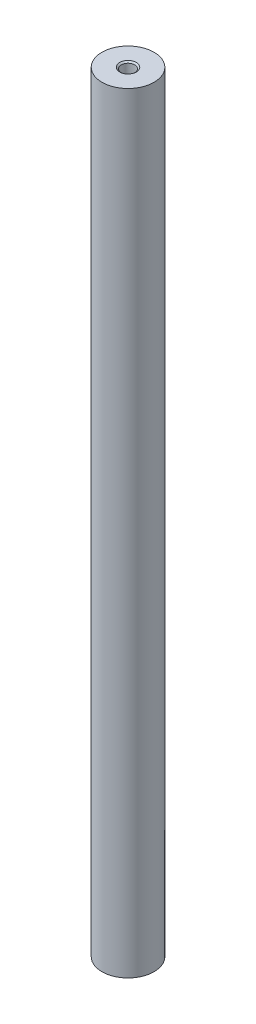
from build123d import *

# Parameters (mm, degrees)
SKETCH1_R                         = 6.35
BOSS_EXTRUDE1_DEPTH               = 187.8203
F_1_4_20_TAPPED_HOLE1_D           = 5.1054
F_1_4_20_TAPPED_HOLE1_DEPTH       = 21.59
F_1_4_20_TAPPED_HOLE1_CSINK_D     = 7.62
F_1_4_20_TAPPED_HOLE1_CSINK_ANGLE = 100
F_1_4_20_TAPPED_HOLE1_TIP         = 1.533816902
M4X0_7_TAPPED_HOLE1_D             = 3.3
M4X0_7_TAPPED_HOLE1_DEPTH         = 17.7292
M4X0_7_TAPPED_HOLE1_CSINK_D       = 4.05
M4X0_7_TAPPED_HOLE1_CSINK_ANGLE   = 100
M4X0_7_TAPPED_HOLE1_TIP           = 0.991420021


with BuildPart() as part:
    # Sketch1 → Boss-Extrude1 (new body)
    with BuildSketch(Plane(origin=(0, 0, 0), x_dir=(1, 0, 0), z_dir=(0, 1, 0))):
        with Locations(Location((0, 0, 0), (0, 0, 90))):
            Circle(SKETCH1_R)
    extrude(amount=BOSS_EXTRUDE1_DEPTH)

    # 1/4-20 Tapped Hole1
    with Locations(Plane(origin=(0, 0, 0), x_dir=(-1, 0, 0), z_dir=(0, -1, 0))):
        with Locations((0, 0)):
            CounterSinkHole(F_1_4_20_TAPPED_HOLE1_D / 2, F_1_4_20_TAPPED_HOLE1_CSINK_D / 2, depth=F_1_4_20_TAPPED_HOLE1_DEPTH, counter_sink_angle=F_1_4_20_TAPPED_HOLE1_CSINK_ANGLE)
            with Locations((0, 0, -(F_1_4_20_TAPPED_HOLE1_DEPTH + F_1_4_20_TAPPED_HOLE1_TIP / 2))):  # 118° drill point
                Cone(0, F_1_4_20_TAPPED_HOLE1_D / 2, F_1_4_20_TAPPED_HOLE1_TIP, mode=Mode.SUBTRACT)

    # M4x0.7 Tapped Hole1
    with Locations(Plane(origin=(0, 187.8203, 0), x_dir=(1, 0, 0), z_dir=(0, 1, 0))):
        with Locations((0, 0)):
            CounterSinkHole(M4X0_7_TAPPED_HOLE1_D / 2, M4X0_7_TAPPED_HOLE1_CSINK_D / 2, depth=M4X0_7_TAPPED_HOLE1_DEPTH, counter_sink_angle=M4X0_7_TAPPED_HOLE1_CSINK_ANGLE)
            with Locations((0, 0, -(M4X0_7_TAPPED_HOLE1_DEPTH + M4X0_7_TAPPED_HOLE1_TIP / 2))):  # 118° drill point
                Cone(0, M4X0_7_TAPPED_HOLE1_D / 2, M4X0_7_TAPPED_HOLE1_TIP, mode=Mode.SUBTRACT)


solid = part.part
